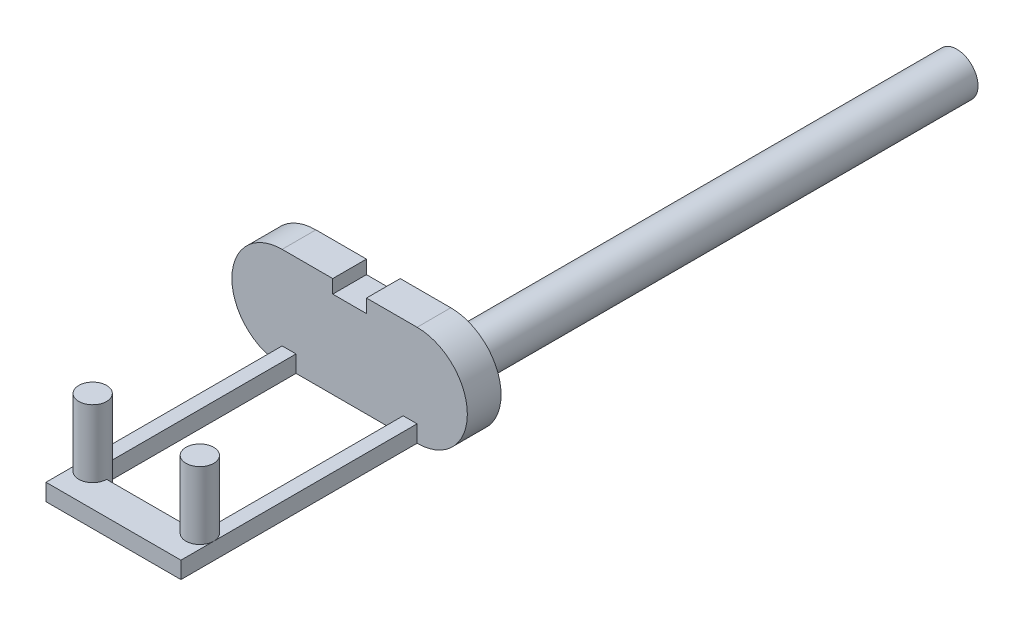
from build123d import *

# Parameters (mm, degrees)
EXTRUDE_1_DEPTH      = 38
EXTRUDE_1_DEPTH_BACK = 37
SKETCH_1_R           = 3.135440561
EXTRUDE_2_DEPTH      = 5
SKETCH_3_W           = 2.059190546
SKETCH_3_H           = 2.5
EXTRUDE_3_DEPTH      = 35
SKETCH_4_W           = 20.000000251
SKETCH_4_H           = 4.860537913
EXTRUDE_4_DEPTH      = 2.5
EXTRUDE_START        = -2.5
SKETCH_5_R           = 2.059190546
EXTRUDE_5_DEPTH      = 12.5
SKETCH_6_W           = 5
SKETCH_6_H           = 15.228523458
CUT_EXTRUDE_1_DEPTH  = 2


with BuildPart() as part:
    # 草图1 → 凸台-拉伸1 (new, two sides: drawn at the far end of the back side and taken through both)
    with BuildSketch(Plane.XY.offset(-EXTRUDE_1_DEPTH_BACK)):
        with Locations((-61.264027464, 50.387155503)):
            Circle(SKETCH_1_R)
    extrude(amount=EXTRUDE_1_DEPTH + EXTRUDE_1_DEPTH_BACK)

    # 草图2 → 凸台-拉伸2 (add)
    with BuildSketch(Plane.XY.offset(38)):
        with BuildLine():
            Line((-61.264027464, 42.939057926), (-81.264027464, 42.939057926))
            ThreePointArc((-81.264027464, 42.939057926), (-88.712125041, 50.387155503), (-81.264027464, 57.835253081))
            Line((-81.264027464, 57.835253081), (-61.264027464, 57.835253081))
            ThreePointArc((-61.264027464, 57.835253081), (-53.815929886, 50.387155503), (-61.264027464, 42.939057926))
        make_face()
    extrude(amount=EXTRUDE_2_DEPTH)

    # 草图3 → 凸台-拉伸3 (add)
    with BuildSketch(Plane.XY.offset(43)):
        with Locations((-62.293622611, 44.189057926)):
            Rectangle(SKETCH_3_W, SKETCH_3_H)
        with Locations((-80.234432316, 44.189057926)):
            Rectangle(SKETCH_3_W, SKETCH_3_H)
    extrude(amount=EXTRUDE_3_DEPTH)

    # 草图4 → 凸台-拉伸4 (add)
    with BuildSketch(Plane(origin=(0, 45.439057926, 0), x_dir=(1, 0, 0), z_dir=(0, 1, 0))):
        with Locations((-71.264027464, -75.569731043)):
            Rectangle(SKETCH_4_W, SKETCH_4_H)
    extrude(amount=-EXTRUDE_4_DEPTH)

    # 草图5 → 凸台-拉伸5 (add)
    with BuildSketch(Plane(origin=(0, 45.439057926, 0), x_dir=(1, 0, 0), z_dir=(0, 1, 0)).offset(EXTRUDE_START)):
        with Locations(Location((-63.323217884, -73.139462087, 0), (0, 0, 270))):
            Circle(SKETCH_5_R)
        with Locations(Location((-79.204837043, -73.139462087, 0), (0, 0, 270))):
            Circle(SKETCH_5_R)
    extrude(amount=EXTRUDE_5_DEPTH)

    # 草图6 → 切除-拉伸1 (cut)
    with BuildSketch(Plane(origin=(0, 57.835253081, 0), x_dir=(1, 0, 0), z_dir=(0, 1, 0))):
        with Locations((-71.264027464, -38)):
            Rectangle(SKETCH_6_W, SKETCH_6_H)
    extrude(amount=-CUT_EXTRUDE_1_DEPTH, mode=Mode.SUBTRACT)


solid = part.part
